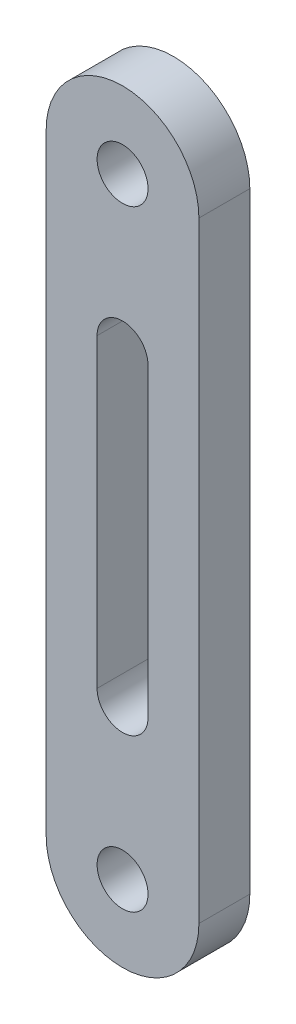
from build123d import *

# Parameters (mm, degrees)
MODEL_R                 = 1.5
SALIENTE_EXTRUIR1_DEPTH = 3


with BuildPart() as part:
    # Model → Saliente-Extruir1 (new body)
    with BuildSketch(Plane.XY):
        with BuildLine():
            Line((213.25077615, 152.428489513), (213.25077615, 188.428489513))
            ThreePointArc((213.25077615, 188.428489513), (208.75077615, 192.928489513), (204.25077615, 188.428489513))
            Line((204.25077615, 188.428489513), (204.25077615, 152.428489513))
            ThreePointArc((204.25077615, 152.428489513), (208.75077615, 147.928489513), (213.25077615, 152.428489513))
        make_face()
        with Locations((208.75077615, 188.428489513)):
            Circle(MODEL_R, mode=Mode.SUBTRACT)
        with Locations((208.75077615, 152.428489513)):
            Circle(MODEL_R, mode=Mode.SUBTRACT)
        with BuildLine():
            Line((207.25077615, 179.428489513), (207.25077615, 161.428489513))
            ThreePointArc((207.25077615, 161.428489513), (208.75077615, 159.928489513), (210.25077615, 161.428489513))
            Line((210.25077615, 161.428489513), (210.25077615, 179.428489513))
            ThreePointArc((210.25077615, 179.428489513), (208.75077615, 180.928489513), (207.25077615, 179.428489513))
        make_face(mode=Mode.SUBTRACT)
    extrude(amount=SALIENTE_EXTRUIR1_DEPTH)


solid = part.part
